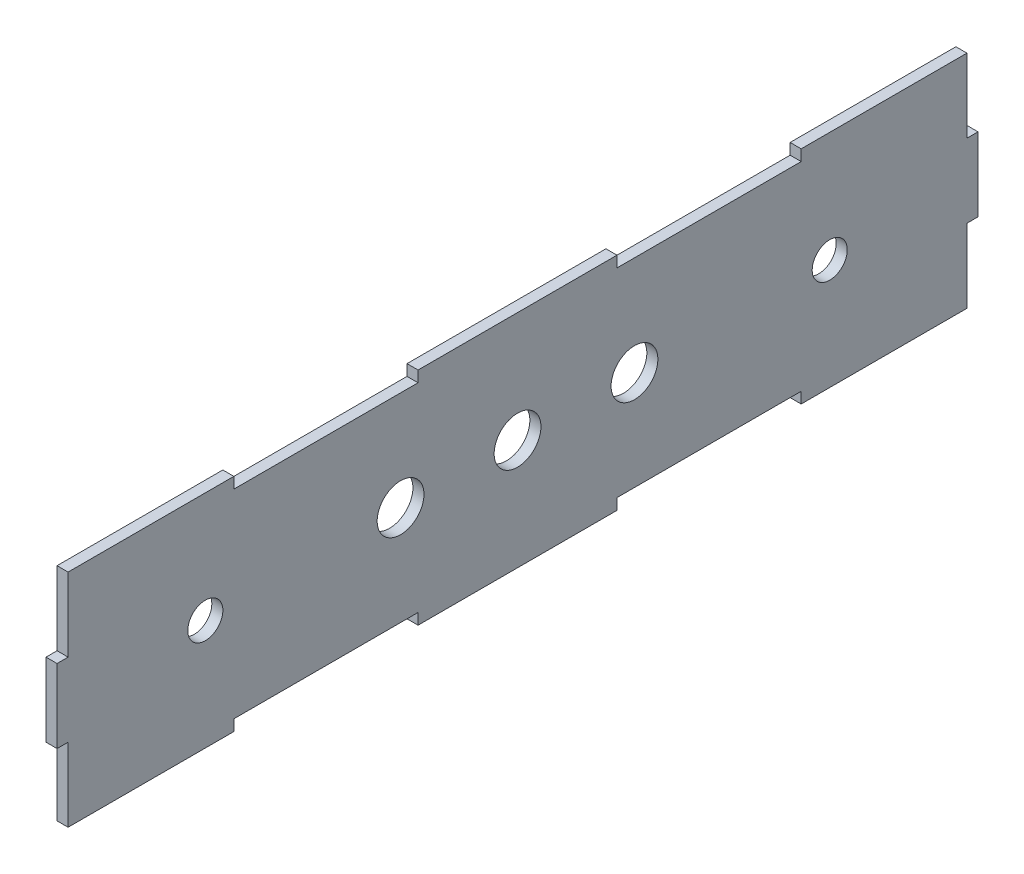
from build123d import *

# Parameters (mm, degrees)
BOSS_EXTRUDE1_DEPTH = 3
SKETCH2_R           = 6.35
SKETCH2_R_2         = 4.7625
CUT_EXTRUDE1_DEPTH  = 129.5846025


with BuildPart() as part:
    # Sketch1 → Boss-Extrude1 (new body)
    with BuildSketch(Plane(origin=(0, 0, 0), x_dir=(0, 0, -1), z_dir=(1, 0, 0))):
        Polygon((-122, 30), (-77, 30), (-77, 27), (-27, 27), (-27, 30), (27, 30), (27, 27), (77, 27), (77, 30), (122, 30), (122, 10), (125, 10), (125, -10), (122, -10), (122, -30), (77, -30), (77, -27), (27, -27), (27, -30), (-27, -30), (-27, -27), (-77, -27), (-77, -30), (-122, -30), (-122, -10), (-125, -10), (-125, 10), (-122, 10), align=None)
    extrude(amount=BOSS_EXTRUDE1_DEPTH)

    # Sketch2 → Cut-Extrude1 (cut, through all)
    with BuildSketch(Plane(origin=(3, 0, 0), x_dir=(0, 0, -1), z_dir=(1, 0, 0))):
        Circle(SKETCH2_R)
        with Locations((-31.75, 0)):
            Circle(SKETCH2_R)
        with Locations(Location((31.75, 0, 0), (0, 0, 180))):
            Circle(SKETCH2_R)
        with Locations((-84.75, 0)):
            Circle(SKETCH2_R_2)
        with Locations(Location((84.75, 0, 0), (0, 0, 180))):
            Circle(SKETCH2_R_2)
    extrude(amount=-CUT_EXTRUDE1_DEPTH, mode=Mode.SUBTRACT)


solid = part.part
